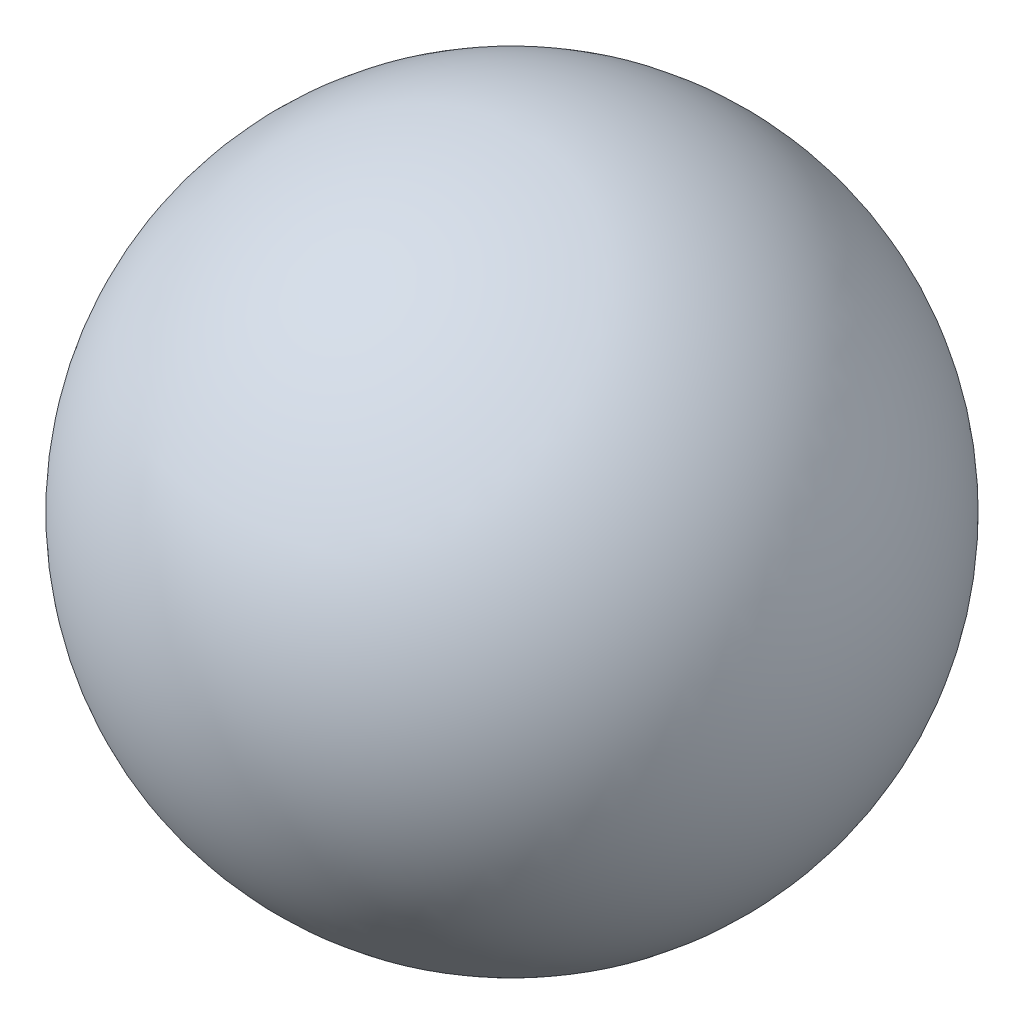
from build123d import *


with BuildPart() as part:
    # Sketch1 → Revolve1 (revolve)
    with BuildSketch(Plane.XY):
        with BuildLine():
            Line((0, -110.159093861), (0, 110.159093861))
            ThreePointArc((0, 110.159093861), (110.159093861, 0), (0, -110.159093861))
        make_face()
    revolve(axis=Axis((0, 0, 0), (0, 1, 0)))


solid = part.part
